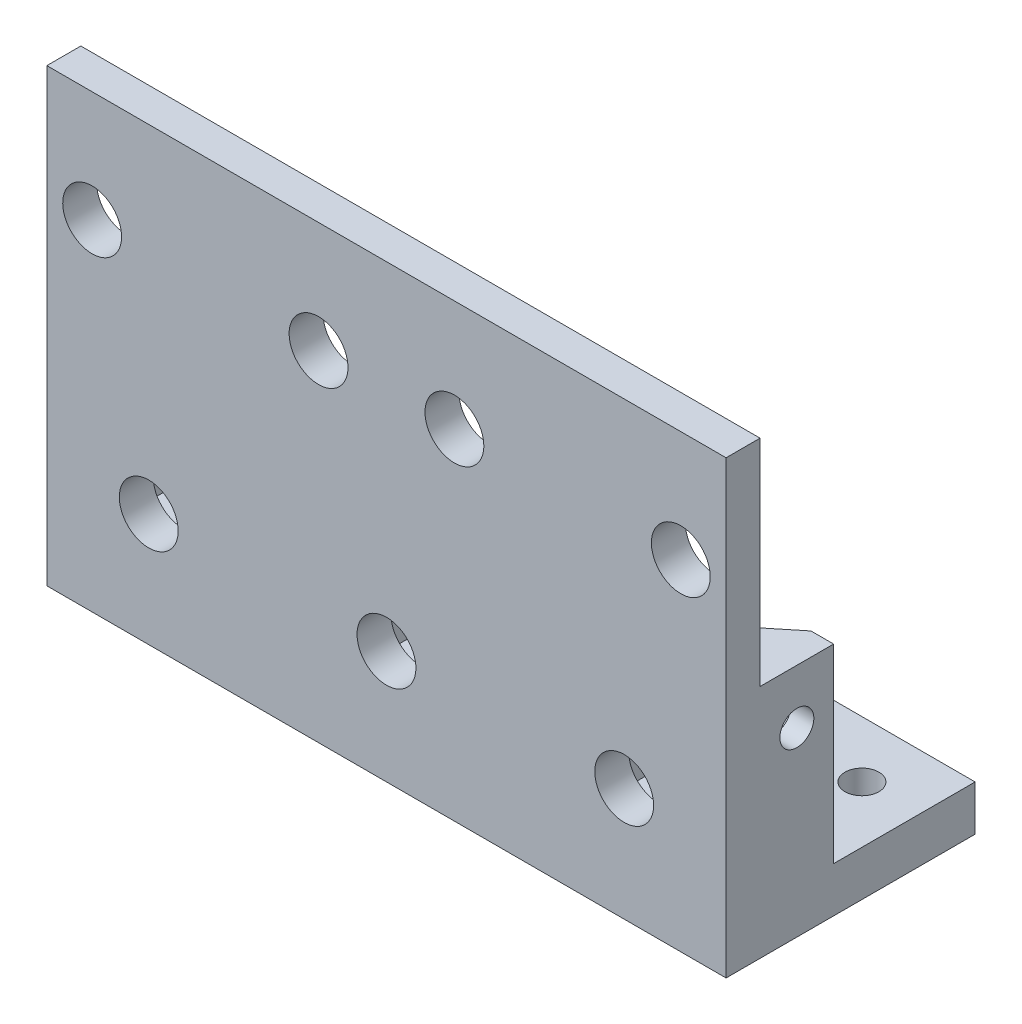
from build123d import *

# Parameters (mm, degrees)
EXTRUDE_1_DEPTH     = 60
SKETCH_2_W          = 15
SKETCH_2_H          = 19
SKETCH_2_W_2        = 12
CUT_EXTRUDE_1_DEPTH = 60
HOLE_WIZARD_1_D     = 5.2
HOLE_WIZARD_2_D     = 3
SKETCH_7_R          = 1.5
EXTRUDE_2_DEPTH     = 2
EXTRUDE_3_DEPTH     = 1.8
HOLE_WIZARD_3_D     = 5.2


with BuildPart() as part:
    # 草图1 → 凸台-拉伸1 (new body)
    with BuildSketch(Plane(origin=(0, 0, 0), x_dir=(0, 0, -1), z_dir=(1, 0, 0))):
        Polygon((-1.5, 19.9), (1.5, 19.9), (1.5, -0.1), (20.5, -15.9), (20.5, -19.9), (1.5, -19.9), (-1.5, -19.9), align=None)
    extrude(amount=EXTRUDE_1_DEPTH)

    # 草图2 → 切除-拉伸1 (cut)
    with BuildSketch(Plane(origin=(0, -15.9, 0), x_dir=(-1, 0, 0), z_dir=(0, -1, 0))):
        with Locations((-52.5, 11)):
            Rectangle(SKETCH_2_W, SKETCH_2_H)
        with Locations((-7.5, 11)):
            Rectangle(SKETCH_2_W, SKETCH_2_H)
        with Locations((-30, 11)):
            Rectangle(SKETCH_2_W_2, SKETCH_2_H)
    extrude(amount=-CUT_EXTRUDE_1_DEPTH, mode=Mode.SUBTRACT)

    # 孔1 (through all)
    with Locations(Plane(origin=(0, 0, -1.5), x_dir=(-1, 0, 0), z_dir=(0, 0, -1))):
        with Locations((-51, -9.9), (-30, -9.9), (-9, -9.9)):
            Hole(HOLE_WIZARD_1_D / 2)

    # 孔2 (through all)
    with Locations(Plane(origin=(0, -19.9, 0), x_dir=(-1, 0, 0), z_dir=(0, -1, 0))):
        with Locations((-55, 15.5), (-30, 15.5), (-5, 15.5)):
            Hole(HOLE_WIZARD_2_D / 2)

    # 草图7 → 凸台-拉伸2 (add)
    with BuildSketch(Plane.ZY):
        Polygon((-1.5, -0.9), (-8, -0.9), (-8, -6.9), (-8, -15.9), (-1.5, -15.9), (-1.5, -6.9), align=None)
        with Locations((-4.75, -3.9)):
            Circle(SKETCH_7_R, mode=Mode.SUBTRACT)
    extrude_2 = extrude(amount=-EXTRUDE_2_DEPTH)

    # 草图8 → 凸台-拉伸3 (add)
    with BuildSketch(Plane(origin=(0, -0.9, 0), x_dir=(1, 0, 0), z_dir=(0, 1, 0))):
        Polygon((2, 8), (10, 1.5), (2, 1.5), (0, 1.5), (0, 8), align=None)
    extrude_3 = extrude(amount=EXTRUDE_3_DEPTH)

    # 孔3 (through all)
    with Locations(Plane(origin=(56, 10.1, -1.5), x_dir=(0, -1, 0), z_dir=(0, 0, -1))):
        with Locations((0, 0), (0, 20), (0, 32), (0, 52)):
            Hole(HOLE_WIZARD_3_D / 2)

    # 镜向1: 凸台-拉伸2, 凸台-拉伸3 across plane
    add(extrude_2.mirror(Plane.ZY.offset(-30)))
    add(extrude_3.mirror(Plane.ZY.offset(-30)))


solid = part.part
